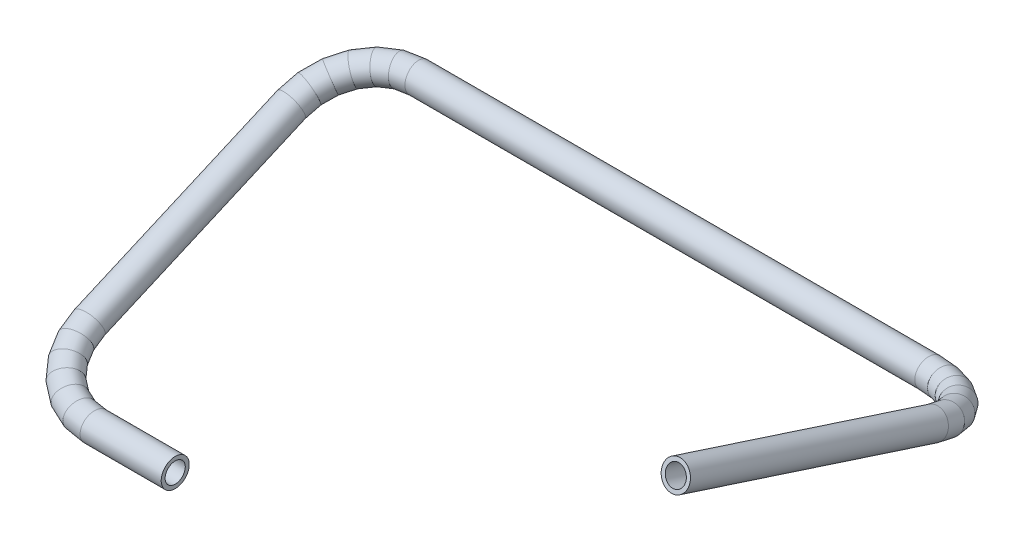
from build123d import *

# Parameters (mm, degrees)
PROFILE_R   = 3.175
PROFILE_R_2 = 2.286


with BuildPart() as part:
    # Tube: sweep along a curve in space
    with BuildLine() as tube_path:
        Line((-2892.892778381, -59.088465181, -10.41889066), (-2911.092778381, -59.088465181, -10.41889066))
        Line((-2911.092778381, -59.088465181, -10.41889066), (-2914.975064057, -58.884473997, -10.887530919))
        Line((-2914.975064057, -58.884473997, -10.887530919), (-2918.592778381, -58.286402109, -12.261514638))
        Line((-2918.592778381, -58.286402109, -12.261514638), (-2921.699380099, -57.335007126, -14.447207097))
        Line((-2921.699380099, -57.335007126, -14.447207097), (-2924.083159438, -56.095125046, -17.295656967))
        Line((-2924.083159438, -56.095125046, -17.295656967), (-2925.581665775, -54.651251782, -20.612747096))
        Line((-2925.581665775, -54.651251782, -20.612747096), (-2926.092778381, -53.101784911, -24.172423273))
        Line((-2926.092778381, -53.101784911, -24.172423273), (-2926.092778381, -33.180175775, -69.939440821))
        Line((-2926.092778381, -33.180175775, -69.939440821), (-2925.581665775, -31.630708904, -73.499116998))
        Line((-2925.581665775, -31.630708904, -73.499116998), (-2924.083159438, -30.18683564, -76.816207127))
        Line((-2924.083159438, -30.18683564, -76.816207127), (-2921.699380099, -28.946953559, -79.664656997))
        Line((-2921.699380099, -28.946953559, -79.664656997), (-2918.592778381, -27.995558577, -81.850349456))
        Line((-2918.592778381, -27.995558577, -81.850349456), (-2914.975064057, -27.397486688, -83.224333175))
        Line((-2914.975064057, -27.397486688, -83.224333175), (-2911.092778381, -27.193495505, -83.692973434))
        Line((-2911.092778381, -27.193495505, -83.692973434), (-2795.092778381, -27.193495505, -83.692973434))
        Line((-2795.092778381, -27.193495505, -83.692973434), (-2791.210492704, -27.035553024, -83.20687646))
        Line((-2791.210492704, -27.035553024, -83.20687646), (-2787.592778381, -26.572489099, -81.781712243))
        Line((-2787.592778381, -26.572489099, -81.781712243), (-2784.486176663, -25.835860773, -79.514603369))
        Line((-2784.486176663, -25.835860773, -79.514603369), (-2782.102397324, -24.875868047, -76.560049562))
        Line((-2782.102397324, -24.875868047, -76.560049562), (-2780.603890986, -23.75793284, -73.11939878))
        Line((-2780.603890986, -23.75793284, -73.11939878), (-2780.092778381, -22.558240589, -69.42712569))
        Line((-2780.092778381, -22.558240589, -69.42712569), (-2780.092778381, -3.615498834, -11.127361241))
    # Profile → Tube (sweep)
    with BuildSketch(Plane(origin=(-2892.892778381, 0, 0), x_dir=(0, 0, -1), z_dir=(1, 0, 0))):
        with Locations((10.41889066, -59.088465181)):
            Circle(PROFILE_R)
        with Locations((10.41889066, -59.088465181)):
            Circle(PROFILE_R_2, mode=Mode.SUBTRACT)
    sweep(path=tube_path.line, transition=Transition.RIGHT)


solid = part.part
